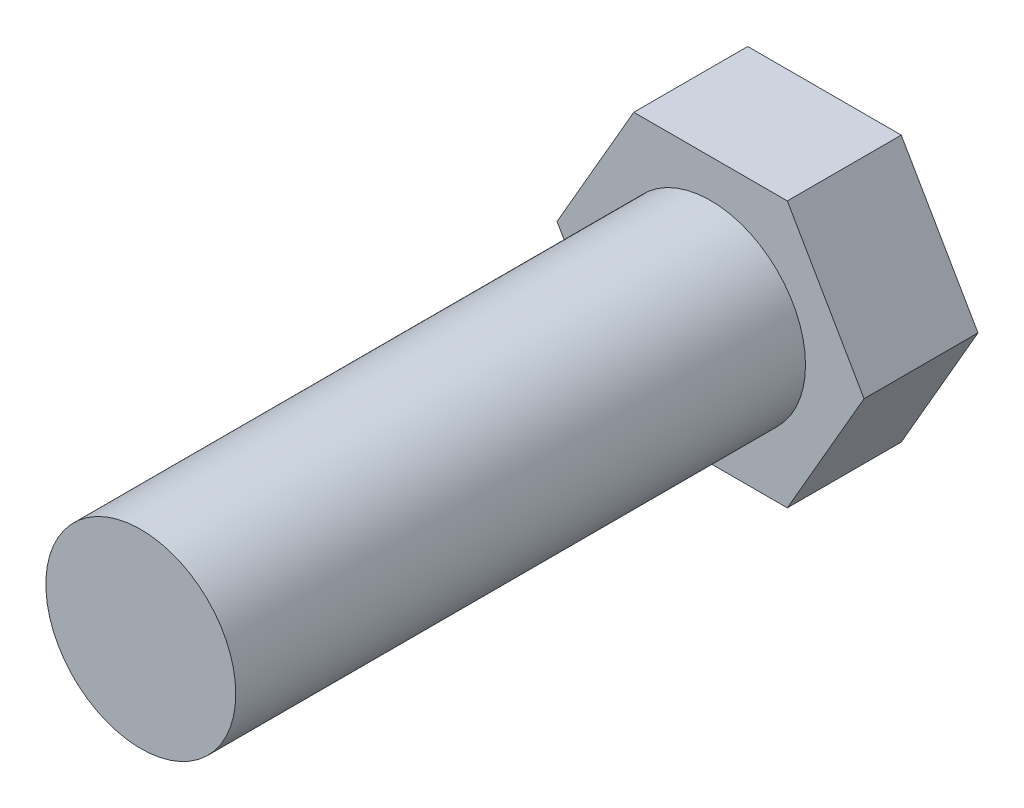
from build123d import *

# Parameters (mm, degrees)
BOSS_EXTRUDE1_DEPTH = 3
SKETCH2_R           = 2.5
BOSS_EXTRUDE2_DEPTH = 15


with BuildPart() as part:
    # Sketch1 → Boss-Extrude1 (new body)
    with BuildSketch(Plane.XY):
        Polygon((4.041451884, 0), (2.020725942, 3.5), (-2.020725942, 3.5), (-4.041451884, 0), (-2.020725942, -3.5), (2.020725942, -3.5), align=None)
    extrude(amount=BOSS_EXTRUDE1_DEPTH)

    # Sketch2 → Boss-Extrude2 (add)
    with BuildSketch(Plane.XY.offset(3)):
        Circle(SKETCH2_R)
    extrude(amount=BOSS_EXTRUDE2_DEPTH)


solid = part.part
